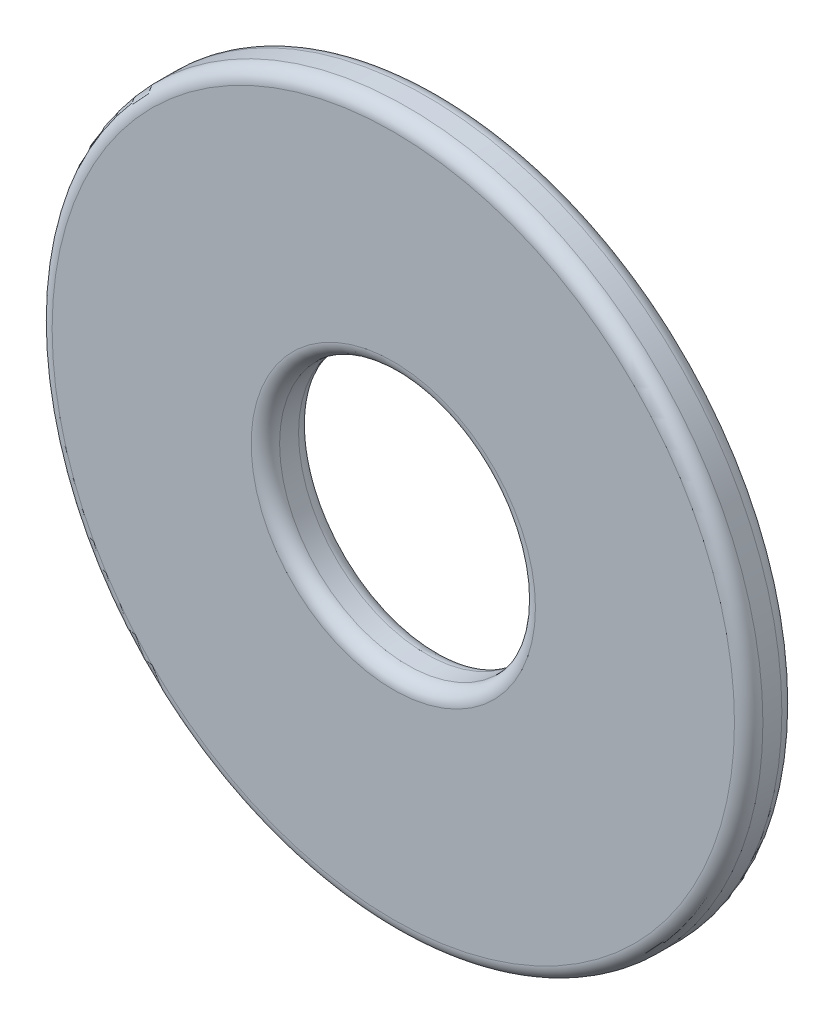
from build123d import *

# Parameters (mm, degrees)
ESBO_O1_R                = 7.5
ESBO_O1_R_2              = 2.7
RESSALTO_EXTRUS_O1_DEPTH = 1
FILETE1_R                = 0.3


with BuildPart() as part:
    # Esboço1 → Ressalto-extrusão1 (new body)
    with BuildSketch(Plane.XY):
        Circle(ESBO_O1_R)
        Circle(ESBO_O1_R_2, mode=Mode.SUBTRACT)
    extrude(amount=RESSALTO_EXTRUS_O1_DEPTH)

    # Filete1
    filete1_edges = [part.edges().sort_by_distance(p)[0] for p in [
        (-7.5, 0, 0),
        (-7.5, 0, 1),
        (-2.7, 0, 0),
        (-2.7, 0, 1),
    ]]
    fillet(filete1_edges, radius=FILETE1_R)


solid = part.part
